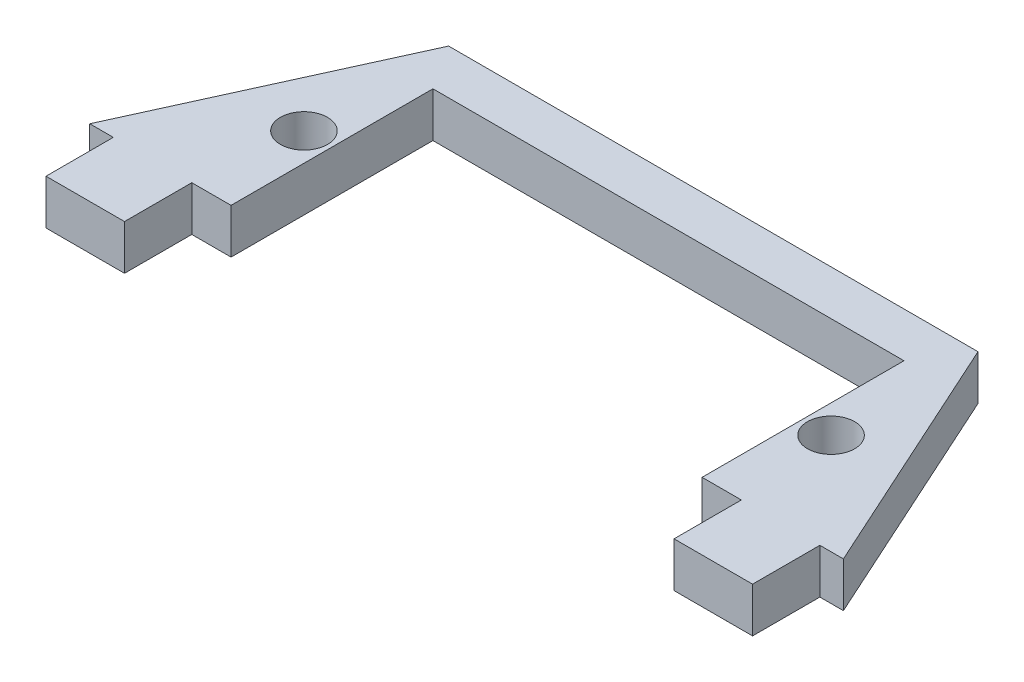
from build123d import *

# Parameters (mm, degrees)
CROQUIS1_R              = 1.05
SALIENTE_EXTRUIR1_DEPTH = 2


with BuildPart() as part:
    # Croquis1 → Saliente-Extruir1 (new body)
    with BuildSketch(Plane(origin=(0, 0, 0), x_dir=(1, 0, 0), z_dir=(0, 1, 0))):
        Polygon((-10.5, 0), (-10.5, 9), (10.5, 9), (10.5, 0), (12.25, 0), (12.25, -3), (15.75, -3), (15.75, 0), (16.8, 0), (11.8, 11), (-11.8, 11), (-16.8, 0), (-15.75, 0), (-15.75, -3), (-12.25, -3), (-12.25, 0), align=None)
        with Locations(Location((-11.75, 4.5, 0), (0, 0, 270))):
            Circle(CROQUIS1_R, mode=Mode.SUBTRACT)
        with Locations(Location((11.75, 4.5, 0), (0, 0, 270))):
            Circle(CROQUIS1_R, mode=Mode.SUBTRACT)
    extrude(amount=SALIENTE_EXTRUIR1_DEPTH)


solid = part.part
